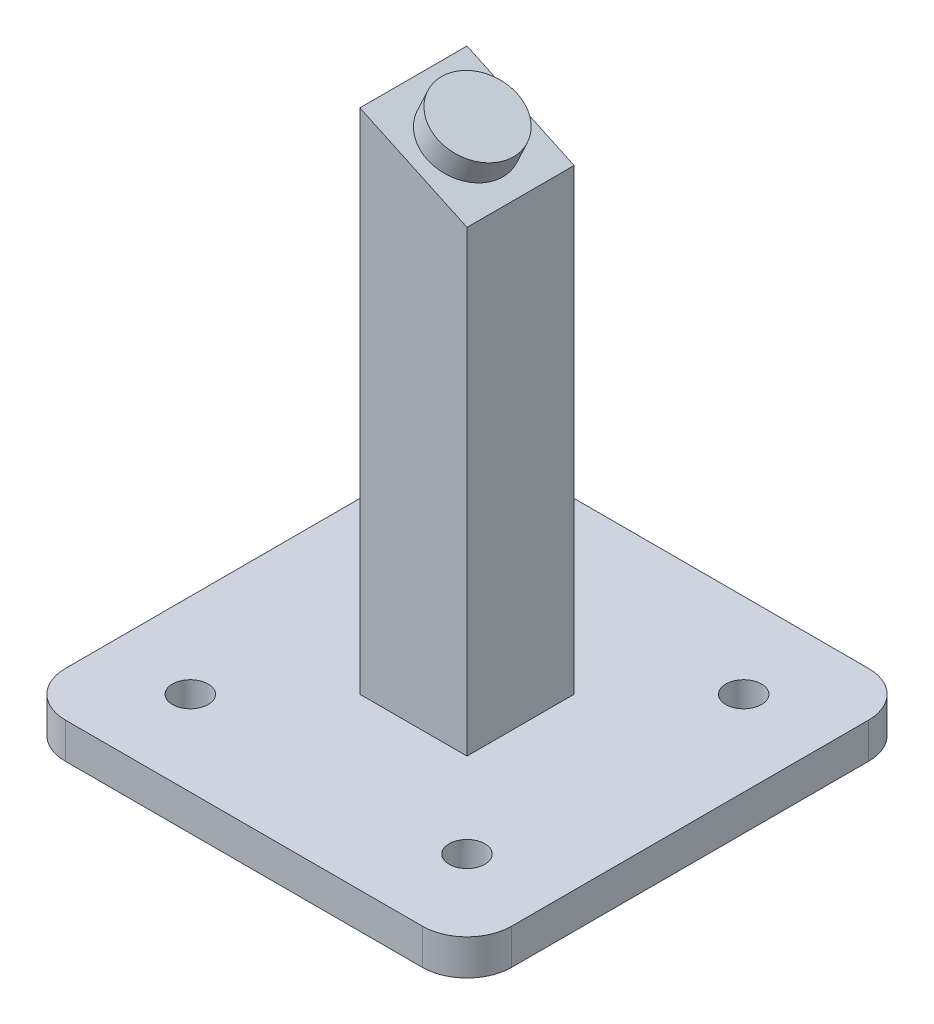
from build123d import *

# Parameters (mm, degrees)
SKETCH1_R           = 2
BOSS_EXTRUDE1_DEPTH = 4
SKETCH3_W           = 12
SKETCH3_H           = 12
BOSS_EXTRUDE3_DEPTH = 51.3
BOSS_EXTRUDE4_DEPTH = 12
SKETCH6_R           = 4.45
BOSS_EXTRUDE5_DEPTH = 2.8


with BuildPart() as part:
    # Sketch1 → Boss-Extrude1 (new body)
    with BuildSketch(Plane(origin=(0, 0, 0), x_dir=(1, 0, 0), z_dir=(0, 1, 0))):
        with BuildLine():
            Line((5, 0), (45, 0))
            ThreePointArc((45, 0), (48.535533906, 1.464466094), (50, 5))
            Line((50, 5), (50, 45))
            ThreePointArc((50, 45), (48.535533906, 48.535533906), (45, 50))
            Line((45, 50), (5, 50))
            ThreePointArc((5, 50), (1.464466094, 48.535533906), (0, 45))
            Line((0, 45), (0, 5))
            ThreePointArc((0, 5), (1.464466094, 1.464466094), (5, 0))
        make_face()
        with Locations(Location((9.5, 9.5, 0), (0, 0, 270))):
            Circle(SKETCH1_R, mode=Mode.SUBTRACT)
        with Locations(Location((9.5, 40.5, 0), (0, 0, 270))):
            Circle(SKETCH1_R, mode=Mode.SUBTRACT)
        with Locations(Location((40.5, 40.5, 0), (0, 0, 270))):
            Circle(SKETCH1_R, mode=Mode.SUBTRACT)
        with Locations(Location((40.5, 9.5, 0), (0, 0, 270))):
            Circle(SKETCH1_R, mode=Mode.SUBTRACT)
    extrude(amount=BOSS_EXTRUDE1_DEPTH)

    # Sketch3 → Boss-Extrude3 (add)
    with BuildSketch(Plane(origin=(0, 4, 0), x_dir=(1, 0, 0), z_dir=(0, 1, 0))):
        with Locations((25, 25)):
            Rectangle(SKETCH3_W, SKETCH3_H)
    extrude(amount=BOSS_EXTRUDE3_DEPTH)

    # Sketch5 → Boss-Extrude4 (add)
    with BuildSketch(Plane.XY.offset(-19)):
        Polygon((31, 55.3), (19, 60.895691898), (19, 55.3), align=None)
    extrude(amount=-BOSS_EXTRUDE4_DEPTH)

    # Sketch6 → Boss-Extrude5 (add)
    with BuildSketch(Plane(origin=(26.717920902, 57.296766276, 0), x_dir=(0.9063077870366527, -0.4226182617406934, 0), z_dir=(0.42261826174069345, 0.9063077870366528, 0))):
        with Locations(Location((-1.89551599, 25, 0), (0, 0, 180))):
            Circle(SKETCH6_R)
    extrude(amount=BOSS_EXTRUDE5_DEPTH)


solid = part.part
